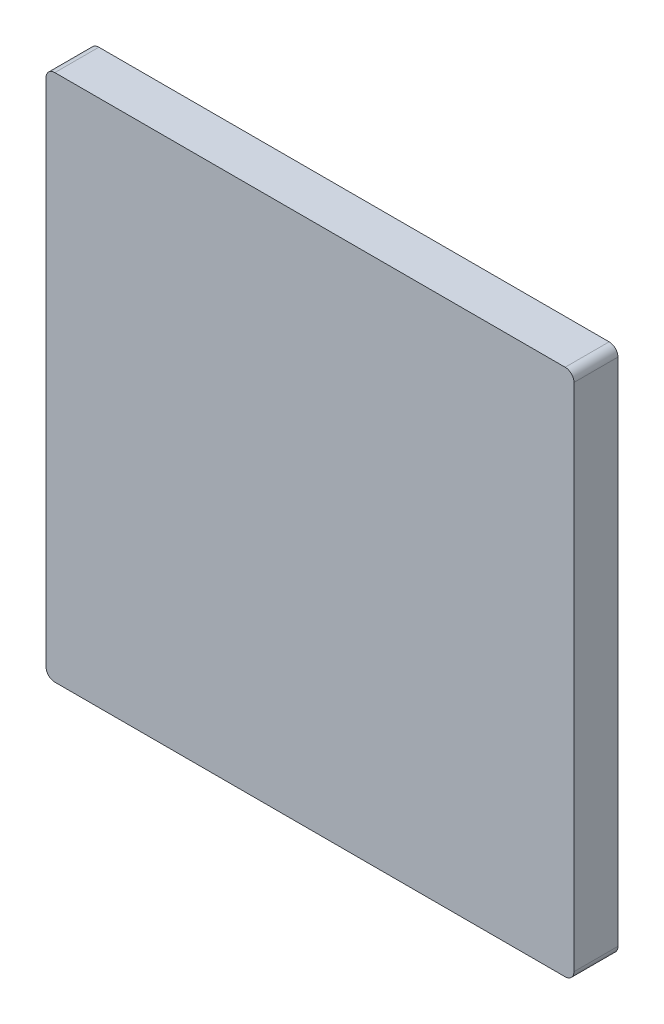
from build123d import *

# Parameters (mm, degrees)
SKETCH_1_W      = 6
SKETCH_1_H      = 6
EXTRUDE_1_DEPTH = 0.5
FILLET_1_R      = 0.1


with BuildPart() as part:
    # 草图1 → 凸台-拉伸1 (new body)
    with BuildSketch(Plane.XY):
        with Locations((-1.89632107, 2.347826087)):
            Rectangle(SKETCH_1_W, SKETCH_1_H)
    extrude(amount=EXTRUDE_1_DEPTH)

    # 圆角1
    fillet_1_edges = [part.edges().sort_by_distance(p)[0] for p in [
        (-4.89632107, 5.347826087, 0.25),
        (1.10367893, 5.347826087, 0.25),
        (1.10367893, -0.652173913, 0.25),
        (-4.89632107, -0.652173913, 0.25),
    ]]
    fillet(fillet_1_edges, radius=FILLET_1_R)


solid = part.part
